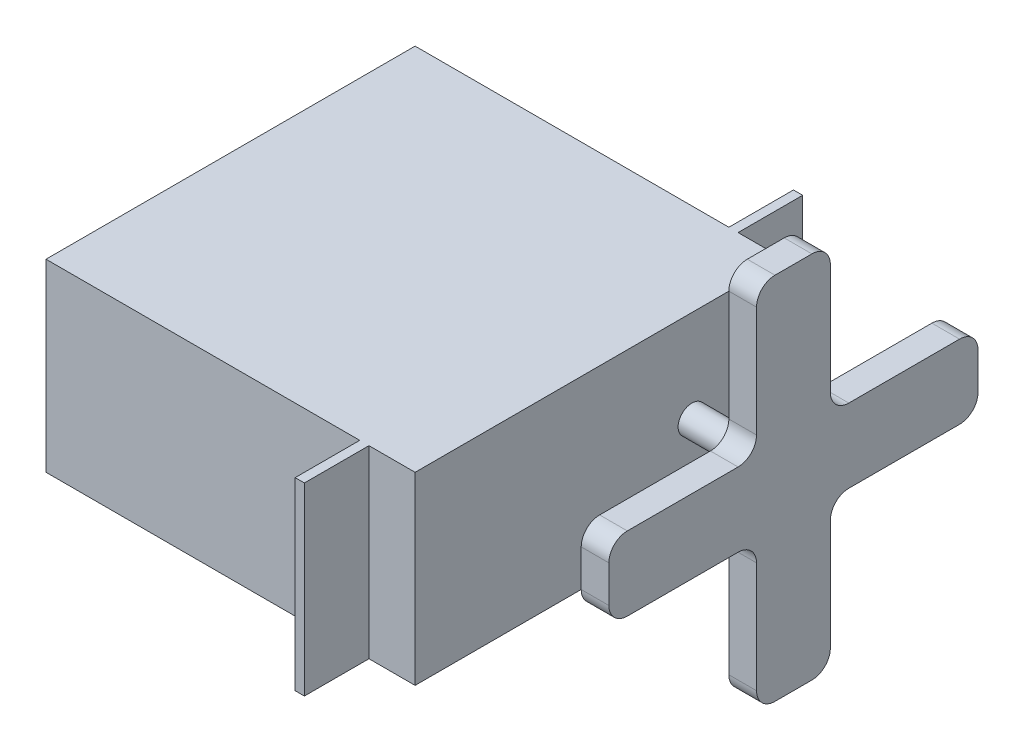
from build123d import *

# Parameters (mm, degrees)
SKETCH1_W           = 40
SKETCH1_H           = 20
BOSS_EXTRUDE1_DEPTH = 40
SKETCH2_R           = 1.5
BOSS_EXTRUDE2_DEPTH = 8
SKETCH4_W           = 8
SKETCH4_H           = 40
SKETCH4_W_2         = 40
SKETCH4_H_2         = 8
BOSS_EXTRUDE4_DEPTH = 3
FILLET1_R           = 2
SKETCH6_W           = 7
SKETCH6_H           = 20
BOSS_EXTRUDE5_DEPTH = 1


with BuildPart() as part:
    # Sketch1 → Boss-Extrude1 (new body)
    with BuildSketch(Plane.XY):
        with Locations((20, 10)):
            Rectangle(SKETCH1_W, SKETCH1_H)
    extrude(amount=BOSS_EXTRUDE1_DEPTH)

    # Sketch2 → Boss-Extrude2 (add)
    with BuildSketch(Plane(origin=(40, 0, 0), x_dir=(0, 0, -1), z_dir=(1, 0, 0))):
        with Locations(Location((-10, 10, 0), (0, 0, 180))):
            Circle(SKETCH2_R)
    extrude(amount=BOSS_EXTRUDE2_DEPTH)

    # Sketch4 → Boss-Extrude4 (add)
    with BuildSketch(Plane(origin=(48, 0, 0), x_dir=(0, 0, -1), z_dir=(1, 0, 0))):
        with Locations((-10, 10)):
            Rectangle(SKETCH4_W, SKETCH4_H)
        with Locations((-10, 10)):
            Rectangle(SKETCH4_W_2, SKETCH4_H_2)
    extrude(amount=BOSS_EXTRUDE4_DEPTH)

    # Fillet1
    fillet1_edges = [part.edges().sort_by_distance(p)[0] for p in [
        (49.5, 14, 30),
        (49.5, 6, 14),
        (49.5, 6, 30),
        (49.5, 6, -10),
        (49.5, 14, 6),
        (49.5, 14, -10),
        (49.5, 30, 6),
        (49.5, 14, 14),
        (49.5, 30, 14),
        (49.5, -10, 14),
        (49.5, 6, 6),
        (49.5, -10, 6),
    ]]
    fillet(fillet1_edges, radius=FILLET1_R)

    # Sketch6 → Boss-Extrude5 (add)
    with BuildSketch(Plane(origin=(34, 0, 0), x_dir=(0, 0, -1), z_dir=(1, 0, 0))):
        with Locations((-43.5, 10)):
            Rectangle(SKETCH6_W, SKETCH6_H)
        with Locations((3.5, 10)):
            Rectangle(SKETCH6_W, SKETCH6_H)
    extrude(amount=BOSS_EXTRUDE5_DEPTH)


solid = part.part
